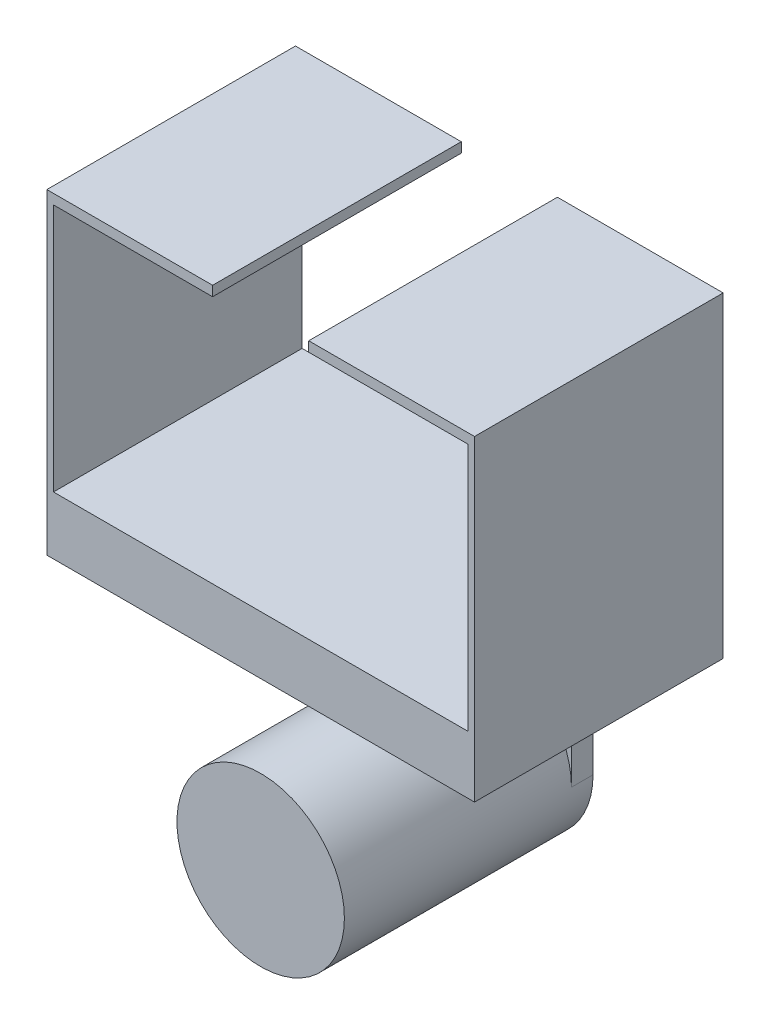
from build123d import *

# Parameters (mm, degrees)
SKETCH1_R            = 12.827
BOSS_EXTRUDE1_DEPTH  = 38.1
SKETCH2_W            = 25.654
SKETCH2_H            = 25.4
BOSS_EXTRUDE2_DEPTH  = 3.302
SKETCH8_W            = 63.5
SKETCH8_H            = 38.1
BOSS_EXTRUDE6_DEPTH  = 8.89
SKETCH10_W           = 38.1
SKETCH10_H           = 46.99
BOSS_EXTRUDE7_DEPTH  = 1.016
SKETCH11_W           = 38.1
SKETCH11_H           = 46.99
BOSS_EXTRUDE8_DEPTH  = 1.016
SKETCH13_W           = 25.4
SKETCH13_H           = 38.1
BOSS_EXTRUDE9_DEPTH  = 1.524
SKETCH14_W           = 25.4
SKETCH14_H           = 38.1
BOSS_EXTRUDE10_DEPTH = 1.524


with BuildPart() as part:
    # Sketch1 → Boss-Extrude1 (new body)
    with BuildSketch(Plane.XY):
        with Locations(Location((0, -30.101764051, 0), (0, 0, 180))):
            Circle(SKETCH1_R)
    extrude(amount=BOSS_EXTRUDE1_DEPTH)

    # Sketch2 → Boss-Extrude2 (add)
    with BuildSketch(Plane.XY):
        with Locations((0, -17.401764051)):
            Rectangle(SKETCH2_W, SKETCH2_H)
    extrude(amount=BOSS_EXTRUDE2_DEPTH)

    # Sketch8 → Boss-Extrude6 (add)
    with BuildSketch(Plane(origin=(0, -4.701764051, 0), x_dir=(1, 0, 0), z_dir=(0, 1, 0))):
        with Locations((0, -19.05)):
            Rectangle(SKETCH8_W, SKETCH8_H)
    extrude(amount=BOSS_EXTRUDE6_DEPTH)

    # Sketch10 → Boss-Extrude7 (add)
    with BuildSketch(Plane(origin=(31.75, 0, 0), x_dir=(0, 0, -1), z_dir=(1, 0, 0))):
        with Locations((-19.05, 18.793235949)):
            Rectangle(SKETCH10_W, SKETCH10_H)
    extrude(amount=BOSS_EXTRUDE7_DEPTH)

    # Sketch11 → Boss-Extrude8 (add)
    with BuildSketch(Plane.ZY.offset(31.75)):
        with Locations((19.05, 18.793235949)):
            Rectangle(SKETCH11_W, SKETCH11_H)
    extrude(amount=BOSS_EXTRUDE8_DEPTH)

    # Sketch13 → Boss-Extrude9 (add)
    with BuildSketch(Plane(origin=(0, 42.288235949, 0), x_dir=(1, 0, 0), z_dir=(0, 1, 0))):
        with Locations((20.066, -19.05)):
            Rectangle(SKETCH13_W, SKETCH13_H)
    extrude(amount=BOSS_EXTRUDE9_DEPTH)

    # Sketch14 → Boss-Extrude10 (add)
    with BuildSketch(Plane(origin=(0, 42.288235949, 0), x_dir=(1, 0, 0), z_dir=(0, 1, 0))):
        with Locations((-20.066, -19.05)):
            Rectangle(SKETCH14_W, SKETCH14_H)
    extrude(amount=BOSS_EXTRUDE10_DEPTH)


solid = part.part
